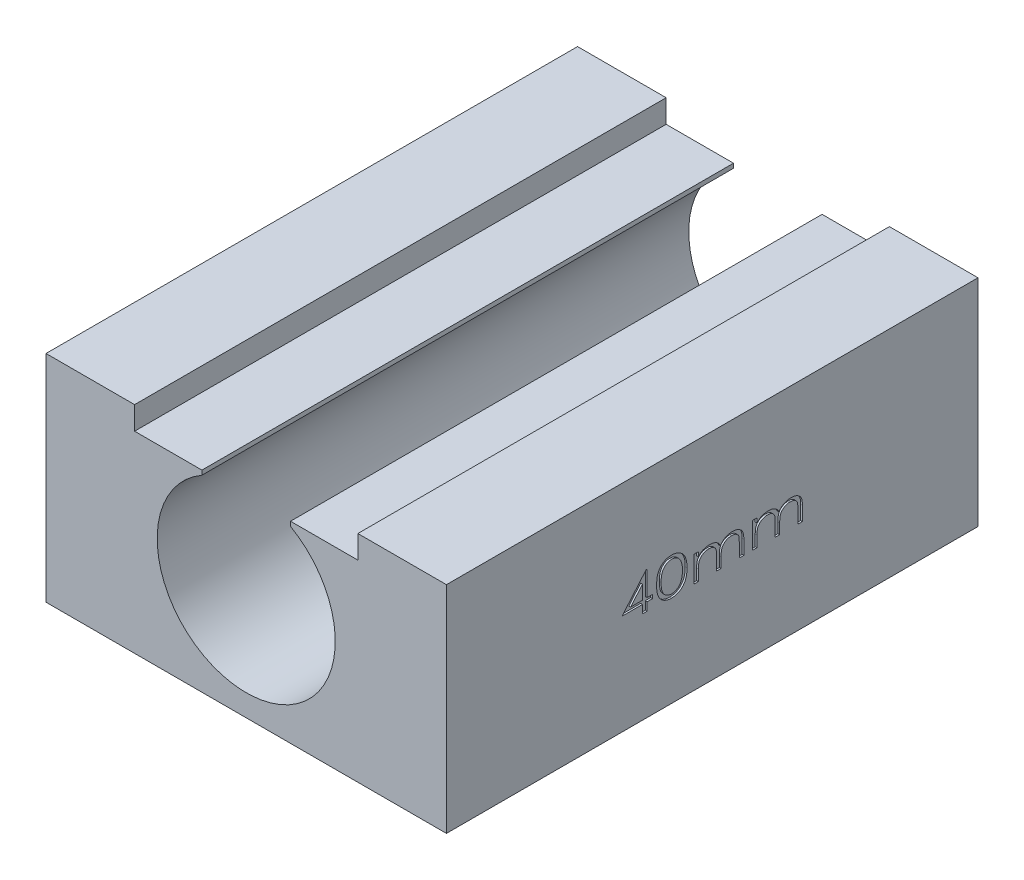
from build123d import *

# Parameters (mm, degrees)
BOSS_EXTRUDE1_DEPTH = 120
CUT_EXTRUDE1_DEPTH  = 0.4


with BuildPart() as part:
    # Sketch1 → Boss-Extrude1 (new body)
    with BuildSketch(Plane.XY):
        with BuildLine():
            Line((-25.2, 23.635882541), (-45.2, 23.635882541))
            Line((-45.2, 23.635882541), (-45.2, -25))
            Line((-45.2, -25), (45.2, -25))
            Line((45.2, -25), (45.2, 23.635882541))
            Line((45.2, 23.635882541), (25.2, 23.635882541))
            Line((25.2, 23.635882541), (25.2, 18.435882541))
            Line((25.2, 18.435882541), (10, 18.435882541))
            Line((10, 18.435882541), (10, 17.435882541))
            ThreePointArc((10, 17.435882541), (17.39267087, 10.074968983), (20.1, 0))
            ThreePointArc((20.1, 0), (-10.074968983, -17.39267087), (-10, 17.435882541))
            Line((-10, 17.435882541), (-10, 18.435882541))
            Line((-10, 18.435882541), (-25.2, 18.435882541))
            Line((-25.2, 18.435882541), (-25.2, 23.635882541))
        make_face()
    extrude(amount=BOSS_EXTRUDE1_DEPTH)

    # Sketch2 → Cut-Extrude1 (cut)
    # profile 1 of 4: a face of its own
    with BuildSketch(Plane(origin=(45.2, 0, 0), x_dir=(0, 0, -1), z_dir=(1, 0, 0))):
        Polygon((-74.924803049, 4.005721857), (-74.714867151, 4.005721857), (-74.714867151, -1.532739682), (-73.484097921, -1.532739682), (-73.484097921, -2.353252502), (-74.714867151, -2.353252502), (-74.714867151, -4.199406349), (-75.740508177, -4.199406349), (-75.740508177, -2.353252502), (-80.355892792, -2.353252502), align=None)
        Polygon((-75.740508177, -1.532739682), (-75.740508177, 1.606683395), (-78.421597921, -1.532739682), align=None, mode=Mode.SUBTRACT)
    # profile 2 of 4: a face of its own
    with BuildSketch(Plane(origin=(45.2, 0, 0), x_dir=(0, 0, -1), z_dir=(1, 0, 0))):
        with BuildLine():
            add(Edge.make_bspline(
                [(-72.561020998, -0.202611477), (-72.560026912, -0.074372807), (-72.558095312, 0.174806763), (-72.536395121, 0.53777982), (-72.503724806, 0.878469267), (-72.457297257, 1.196708698), (-72.399109436, 1.492473004), (-72.325084077, 1.765318934), (-72.239724216, 2.016757003), (-72.137309444, 2.245729747), (-72.024081299, 2.457321088), (-71.901208367, 2.654986597), (-71.76515028, 2.838404843), (-71.620265618, 3.010488209), (-71.461989685, 3.167198975), (-71.295461467, 3.313425394), (-71.114472531, 3.441898769), (-70.926158016, 3.561718227), (-70.727280656, 3.664316982), (-70.523882318, 3.756389772), (-70.314128593, 3.834134048), (-70.097899128, 3.895603635), (-69.876567228, 3.945991337), (-69.64953693, 3.980993014), (-69.416678653, 4.002496136), (-69.25925177, 4.004638202), (-69.179610741, 4.005721857)],
                knots=[0, 0, 0, 0, 1.503649737, 2.921730219, 4.262503284, 5.516075274, 6.69178641, 7.795021393, 8.829149449, 9.802301691, 10.73274031, 11.64178177, 12.528843777, 13.408754628, 14.276947477, 15.13851592, 16.004377863, 16.876899079, 17.753928666, 18.625955013, 19.494057458, 20.374325017, 21.26034682, 22.154305278, 23.06627747, 24, 24, 24, 24], degree=3))
            add(Edge.make_bspline(
                [(-69.179610741, 4.005721857), (-69.098901053, 4.00464507), (-68.939340692, 4.002516299), (-68.702771437, 3.980858252), (-68.471977342, 3.94612623), (-68.247365841, 3.895908458), (-68.028225564, 3.833530675), (-67.815017349, 3.756665929), (-67.607395616, 3.66478317), (-67.406292464, 3.559054828), (-67.211336658, 3.441527617), (-67.029057122, 3.306066042), (-66.856990896, 3.157868724), (-66.693744708, 2.997024802), (-66.542221441, 2.820754369), (-66.400615411, 2.630477857), (-66.268866316, 2.426812752), (-66.148716005, 2.207685193), (-66.03797916, 1.973326878), (-65.946406835, 1.71835279), (-65.865993941, 1.445610312), (-65.800194585, 1.153397717), (-65.751915486, 0.841097491), (-65.714441122, 0.510233498), (-65.694472798, 0.159812469), (-65.69100509, -0.079726142), (-65.689226126, -0.202611477)],
                knots=[0, 0, 0, 0, 0.937767327, 1.853934702, 2.758288811, 3.648489533, 4.526834912, 5.404653573, 6.280208139, 7.163258016, 8.043794659, 8.922907602, 9.798968251, 10.681341352, 11.583668834, 12.497519514, 13.43602634, 14.400218243, 15.40010499, 16.445002713, 17.545098876, 18.703307102, 19.92297783, 21.215983973, 22.571776222, 24, 24, 24, 24], degree=3))
            add(Edge.make_bspline(
                [(-65.689226126, -0.202611477), (-65.690067951, -0.324984732), (-65.691709025, -0.56354203), (-65.715724871, -0.912053268), (-65.749476082, -1.241673638), (-65.79922102, -1.55198649), (-65.862598025, -1.842820776), (-65.94200175, -2.114322349), (-66.031185637, -2.368495988), (-66.140743754, -2.601650864), (-66.259249543, -2.819190409), (-66.389753149, -3.021919862), (-66.53093541, -3.211633199), (-66.683121406, -3.387753934), (-66.845311282, -3.550793212), (-67.019542145, -3.698458732), (-67.203793208, -3.833746481), (-67.399063917, -3.953017929), (-67.601796543, -4.058699916), (-67.80978741, -4.152792406), (-68.025378695, -4.228564642), (-68.244983238, -4.293387459), (-68.470399772, -4.343349399), (-68.701780838, -4.377668852), (-68.938717282, -4.401802553), (-69.09888677, -4.403619054), (-69.179610741, -4.404534554)],
                knots=[0, 0, 0, 0, 1.42287291, 2.773781872, 4.060828387, 5.27520363, 6.426792035, 7.519939846, 8.563431598, 9.555755978, 10.512173935, 11.442739076, 12.357218209, 13.260166218, 14.147528077, 15.028911135, 15.913637702, 16.80332344, 17.686980587, 18.571336277, 19.455604679, 20.342248599, 21.23306151, 22.138037539, 23.061587774, 24, 24, 24, 24], degree=3))
            add(Edge.make_bspline(
                [(-69.179610741, -4.404534554), (-69.259250248, -4.40344324), (-69.416674121, -4.401286033), (-69.649554421, -4.379893706), (-69.875873315, -4.344580573), (-70.096248239, -4.296039144), (-70.311657786, -4.236261174), (-70.519894463, -4.158360741), (-70.722509128, -4.068067447), (-70.919636589, -3.966819674), (-71.10701233, -3.848968756), (-71.285854158, -3.719567227), (-71.453096858, -3.574217189), (-71.609440358, -3.415668617), (-71.756741902, -3.245136439), (-71.891275029, -3.059587568), (-72.016189851, -2.861062254), (-72.130895191, -2.647757735), (-72.234811884, -2.417193034), (-72.32237251, -2.164447606), (-72.395197832, -1.889928097), (-72.455671958, -1.594520166), (-72.50417061, -1.27742136), (-72.536267816, -0.938181633), (-72.558100708, -0.577363701), (-72.560030001, -0.329783169), (-72.561020998, -0.202611477)],
                knots=[0, 0, 0, 0, 0.934912173, 1.848046295, 2.743143733, 3.622812651, 4.496445533, 5.365654014, 6.230506444, 7.100190045, 7.965178933, 8.827069452, 9.689735607, 10.563481063, 11.439744394, 12.332993909, 13.25184041, 14.191956137, 15.174630498, 16.218062315, 17.328758704, 18.507220368, 19.757112638, 21.093352049, 22.506977365, 24, 24, 24, 24], degree=3))
        make_face()
        with BuildLine():
            add(Edge.make_bspline(
                [(-71.535379972, -0.199406349), (-71.534564195, -0.306264938), (-71.532980796, -0.513674324), (-71.517741073, -0.815060703), (-71.496549832, -1.096372406), (-71.46445813, -1.357336168), (-71.423389501, -1.598174072), (-71.372124487, -1.819042342), (-71.313888532, -2.020355297), (-71.244044335, -2.202316928), (-71.164624153, -2.368286309), (-71.077972831, -2.523428028), (-70.98184759, -2.667387449), (-70.87720065, -2.80166419), (-70.762920566, -2.92476742), (-70.641340286, -3.039647479), (-70.509012713, -3.1418699), (-70.324380814, -3.265003012), (-70.081655673, -3.392295059), (-69.777555073, -3.502065028), (-69.465264431, -3.570924676), (-69.253672719, -3.579647324), (-69.147559459, -3.584021733)],
                knots=[0, 0, 0, 0, 1.365459738, 2.650317286, 3.855581839, 4.969875765, 6.009123991, 6.976181044, 7.866094672, 8.685079231, 9.463722796, 10.215633472, 10.954035672, 11.673708734, 12.388704326, 13.098696342, 13.808786807, 14.5225756, 15.933291021, 17.298050938, 18.644972337, 20, 20, 20, 20], degree=3))
            add(Edge.make_bspline(
                [(-69.147559459, -3.584021733), (-69.040886464, -3.580391545), (-68.828673031, -3.573169711), (-68.517953712, -3.50354037), (-68.21703025, -3.397709348), (-67.97928308, -3.272420355), (-67.798904139, -3.151484135), (-67.669184097, -3.050369056), (-67.549763745, -2.935968246), (-67.437312032, -2.812722457), (-67.333241775, -2.678899576), (-67.241938389, -2.53187426), (-67.153525748, -2.377010766), (-67.104929544, -2.266661218), (-67.080251767, -2.210624297)],
                knots=[0, 0, 0, 0, 1.454656591, 2.893868968, 4.32661569, 5.801378547, 6.547894285, 7.290658755, 8.04398565, 8.803046969, 9.567556165, 10.354696976, 11.164493946, 12, 12, 12, 12], degree=3))
            add(Edge.make_bspline(
                [(-67.080251767, -2.210624297), (-67.051204958, -2.139326447), (-66.992390103, -1.994960408), (-66.916668484, -1.770044126), (-66.855006465, -1.534205295), (-66.803441885, -1.288198653), (-66.763778596, -1.031407107), (-66.734567166, -0.76355236), (-66.719321644, -0.484840004), (-66.71636798, -0.295575979), (-66.714867151, -0.199406349)],
                knots=[0, 0, 0, 0, 0.897532899, 1.817351705, 2.764618306, 3.738200912, 4.746854777, 5.793041112, 6.878590785, 8, 8, 8, 8], degree=3))
            add(Edge.make_bspline(
                [(-66.714867151, -0.199406349), (-66.715600009, -0.103226667), (-66.717034239, 0.085000459), (-66.73377358, 0.360295217), (-66.758959814, 0.622306988), (-66.794280583, 0.87093668), (-66.838067933, 1.106663425), (-66.894914159, 1.328416848), (-66.95967469, 1.537696174), (-67.037457306, 1.732922272), (-67.1213764, 1.916039729), (-67.215771344, 2.084716415), (-67.313997698, 2.243212914), (-67.423785169, 2.386728071), (-67.539019859, 2.520002974), (-67.664551148, 2.637868428), (-67.796243336, 2.744937605), (-67.981219436, 2.866872402), (-68.222476709, 2.993093419), (-68.522894597, 3.105559637), (-68.833279946, 3.171511091), (-69.042558122, 3.180632528), (-69.147559459, 3.185209036)],
                knots=[0, 0, 0, 0, 1.229525781, 2.406226545, 3.524826222, 4.594047567, 5.616071261, 6.588417605, 7.519395492, 8.41479633, 9.273418453, 10.092675396, 10.884690884, 11.655091559, 12.400379745, 13.134697013, 13.85360731, 14.56773274, 15.963844624, 17.325176792, 18.657958416, 20, 20, 20, 20], degree=3))
            add(Edge.make_bspline(
                [(-69.147559459, 3.185209036), (-69.25469801, 3.180686674), (-69.467164667, 3.17171837), (-69.781309581, 3.105786675), (-70.08347431, 2.993474896), (-70.324438884, 2.867144069), (-70.507987279, 2.746473427), (-70.638081783, 2.643339341), (-70.759972284, 2.529885206), (-70.872006915, 2.404842862), (-70.979258224, 2.272995738), (-71.072448697, 2.12670705), (-71.162035625, 1.973328761), (-71.240258336, 1.806241301), (-71.312874843, 1.625187799), (-71.370040308, 1.42382887), (-71.422391944, 1.203228466), (-71.462248601, 0.961566171), (-71.496989962, 0.700362325), (-71.517708378, 0.418370888), (-71.533002531, 0.116467925), (-71.534571665, -0.092012115), (-71.535379972, -0.199406349)],
                knots=[0, 0, 0, 0, 1.368599115, 2.714071407, 4.081120454, 5.476525329, 6.180825298, 6.88552213, 7.595489274, 8.305850116, 9.029726763, 9.764338507, 10.519592943, 11.298209231, 12.119636502, 13.009518955, 13.969893518, 15.015831986, 16.137713852, 17.336131509, 18.62776257, 20, 20, 20, 20], degree=3))
        make_face(mode=Mode.SUBTRACT)
    # profile 3 of 4: a face of its own
    with BuildSketch(Plane(origin=(45.2, 0, 0), x_dir=(0, 0, -1), z_dir=(1, 0, 0))):
        with BuildLine():
            Line((-64.150764587, 1.646747498), (-63.125123562, 1.646747498))
            Line((-63.125123562, 1.646747498), (-63.125123562, 0.630721857))
            add(Edge.make_bspline(
                [(-63.125123562, 0.630721857), (-63.041653547, 0.719816459), (-62.880494422, 0.891835216), (-62.622398736, 1.117701161), (-62.361455922, 1.306361662), (-62.178588335, 1.404987374), (-62.089867151, 1.452837241)],
                knots=[0, 0, 0, 0, 1.101334499, 2.126393606, 3.090989394, 4, 4, 4, 4], degree=3))
            add(Edge.make_bspline(
                [(-62.089867151, 1.452837241), (-61.967290948, 1.498695485), (-61.722050612, 1.59044487), (-61.339142314, 1.681493905), (-60.94732113, 1.737742561), (-60.683007619, 1.745434924), (-60.549803049, 1.7493116)],
                knots=[0, 0, 0, 0, 0.994664579, 1.990042673, 2.987053289, 4, 4, 4, 4], degree=3))
            add(Edge.make_bspline(
                [(-60.549803049, 1.7493116), (-60.459986164, 1.746891226), (-60.281980961, 1.742094364), (-60.018518742, 1.711844978), (-59.762446701, 1.658277104), (-59.515878041, 1.585302655), (-59.283974938, 1.494744327), (-59.070779994, 1.391102783), (-58.880247119, 1.272258875), (-58.709854845, 1.136733615), (-58.555221307, 0.979432279), (-58.416897689, 0.792607256), (-58.285078187, 0.578415679), (-58.212616914, 0.420079993), (-58.174803049, 0.337452626)],
                knots=[0, 0, 0, 0, 1.097936986, 2.175966114, 3.236309504, 4.292038786, 5.315449249, 6.276199239, 7.185677523, 8.054516777, 8.931828901, 9.873415976, 10.89024361, 12, 12, 12, 12], degree=3))
            add(Edge.make_bspline(
                [(-58.174803049, 0.337452626), (-58.133812949, 0.394062026), (-58.052779246, 0.505973669), (-57.920248597, 0.66360952), (-57.781276862, 0.810936566), (-57.634529132, 0.947842964), (-57.48091772, 1.074903454), (-57.318120294, 1.190251135), (-57.148746328, 1.296199766), (-56.971594989, 1.390427932), (-56.790195145, 1.475688066), (-56.603231876, 1.547123531), (-56.414202776, 1.610089958), (-56.221262333, 1.662273926), (-56.024361241, 1.699147012), (-55.82464073, 1.72958217), (-55.621082929, 1.744724744), (-55.484116527, 1.747776029), (-55.415187664, 1.7493116)],
                knots=[0, 0, 0, 0, 1.039411854, 2.054822818, 3.061019193, 4.05054071, 5.038497512, 6.024150636, 7.01641242, 8.008324128, 9.007340492, 9.996063995, 10.983637224, 11.970538841, 12.966389747, 13.962082115, 14.974410077, 16, 16, 16, 16], degree=3))
            add(Edge.make_bspline(
                [(-55.415187664, 1.7493116), (-55.289466152, 1.745567949), (-55.043667416, 1.73824872), (-54.686381563, 1.682675614), (-54.352769104, 1.584866242), (-54.092500211, 1.474467321), (-53.899771386, 1.36690833), (-53.764263109, 1.280515494), (-53.638801566, 1.185735011), (-53.523557383, 1.082892174), (-53.41687132, 0.973634803), (-53.320445707, 0.856173022), (-53.233718943, 0.730704703), (-53.155816117, 0.596542834), (-53.087605674, 0.449664024), (-53.028586086, 0.28780019), (-52.979506154, 0.108592248), (-52.937889328, -0.086644976), (-52.906195417, -0.299127426), (-52.884116175, -0.528599788), (-52.871717004, -0.775123514), (-52.869734925, -0.945119107), (-52.868713305, -1.032739682)],
                knots=[0, 0, 0, 0, 1.740464184, 3.402789947, 4.989803156, 6.543756859, 7.305282768, 8.043905867, 8.76729876, 9.479833, 10.180755368, 10.879684531, 11.581387001, 12.290573372, 13.025185819, 13.820792516, 14.673231865, 15.595880932, 16.58337464, 17.646144414, 18.78675573, 20, 20, 20, 20], degree=3))
            Line((-52.868713305, -1.032739682), (-52.868713305, -4.199406349))
            Line((-52.868713305, -4.199406349), (-53.894354331, -4.199406349))
            Line((-53.894354331, -4.199406349), (-53.894354331, -1.029534554))
            add(Edge.make_bspline(
                [(-53.894354331, -1.029534554), (-53.89504573, -0.954740906), (-53.896374618, -0.810985543), (-53.904281105, -0.604701029), (-53.916977496, -0.416565818), (-53.933803667, -0.246945277), (-53.957177858, -0.095313389), (-53.988466188, 0.037468709), (-54.02002692, 0.153733054), (-54.074385461, 0.28249911), (-54.159861613, 0.42592123), (-54.292781737, 0.577347893), (-54.456712878, 0.709907312), (-54.646878229, 0.824514671), (-54.862426388, 0.917384594), (-55.099401939, 0.984219641), (-55.356617785, 1.025046038), (-55.53468866, 1.029210463), (-55.626726126, 1.031362882)],
                knots=[0, 0, 0, 0, 1.143235671, 2.197329106, 3.154880607, 4.025032827, 4.80226628, 5.497502554, 6.10988775, 6.640621586, 7.629243892, 8.647760737, 9.703686775, 10.839345356, 12.03156705, 13.279871875, 14.594078343, 16, 16, 16, 16], degree=3))
            add(Edge.make_bspline(
                [(-55.626726126, 1.031362882), (-55.739745514, 1.028101675), (-55.962683799, 1.021668727), (-56.288724179, 0.957474204), (-56.60125091, 0.858864871), (-56.846429118, 0.74108689), (-57.030324595, 0.629201775), (-57.160971439, 0.540800889), (-57.278777614, 0.441265847), (-57.391105345, 0.34001017), (-57.489778169, 0.227695788), (-57.58212065, 0.111758766), (-57.661691934, -0.013264077), (-57.736232245, -0.144643321), (-57.799978277, -0.292035349), (-57.851172588, -0.460195254), (-57.89834413, -0.649285916), (-57.933881403, -0.861576276), (-57.962419341, -1.095788142), (-57.983329665, -1.352386791), (-57.993484666, -1.631482506), (-57.995744962, -1.824934174), (-57.996918433, -1.925367887)],
                knots=[0, 0, 0, 0, 1.556903216, 3.071095483, 4.564446392, 6.066981442, 6.807334089, 7.532765981, 8.239247881, 8.932547991, 9.615914017, 10.298207098, 10.974548501, 11.657159667, 12.37974319, 13.183533278, 14.078680921, 15.065747533, 16.149441298, 17.332010949, 18.614868254, 20, 20, 20, 20], degree=3))
            Line((-57.996918433, -1.925367887), (-57.996918433, -4.199406349))
            Line((-57.996918433, -4.199406349), (-59.022559459, -4.199406349))
            Line((-59.022559459, -4.199406349), (-59.022559459, -1.226649938))
            add(Edge.make_bspline(
                [(-59.022559459, -1.226649938), (-59.0235274, -1.142787342), (-59.025389565, -0.981448849), (-59.029661175, -0.749898127), (-59.045887735, -0.539551398), (-59.06146252, -0.350000843), (-59.086594901, -0.182424669), (-59.111810369, -0.034493752), (-59.147374684, 0.091014565), (-59.197755418, 0.231675513), (-59.284201697, 0.384240916), (-59.415714512, 0.547467097), (-59.580524026, 0.689037937), (-59.773554718, 0.810351456), (-59.990820493, 0.908766559), (-60.229557993, 0.982308043), (-60.488577721, 1.022990742), (-60.667722514, 1.028521862), (-60.759738946, 1.031362882)],
                knots=[0, 0, 0, 0, 1.211839033, 2.33138837, 3.344841969, 4.259525628, 5.078153091, 5.792650174, 6.42558092, 6.960361837, 7.948398424, 8.941636425, 9.97554415, 11.071839529, 12.22542993, 13.411959769, 14.670671777, 16, 16, 16, 16], degree=3))
            add(Edge.make_bspline(
                [(-60.759738946, 1.031362882), (-60.868460347, 1.027873461), (-61.084347418, 1.020944551), (-61.401952371, 0.958966902), (-61.70879632, 0.860977592), (-62.000150434, 0.725434177), (-62.268291654, 0.558174404), (-62.50173878, 0.358978893), (-62.698825725, 0.133474497), (-62.832207328, -0.078296011), (-62.917149199, -0.266341458), (-62.973361356, -0.424981374), (-63.021217307, -0.601176421), (-63.058481614, -0.795257142), (-63.089600462, -1.00638085), (-63.109093834, -1.234904077), (-63.122348427, -1.48130193), (-63.124175895, -1.651309764), (-63.125123562, -1.739470451)],
                knots=[0, 0, 0, 0, 1.253911763, 2.489880891, 3.720346689, 4.964532809, 6.189408473, 7.357155804, 8.493500514, 9.634703169, 10.23074931, 10.872413263, 11.57546153, 12.336099474, 13.15231585, 14.037710173, 14.982418548, 16, 16, 16, 16], degree=3))
            Line((-63.125123562, -1.739470451), (-63.125123562, -4.199406349))
            Line((-63.125123562, -4.199406349), (-64.150764587, -4.199406349))
            Line((-64.150764587, -4.199406349), (-64.150764587, 1.646747498))
        make_face()
    # profile 4 of 4: a face of its own
    with BuildSketch(Plane(origin=(45.2, 0, 0), x_dir=(0, 0, -1), z_dir=(1, 0, 0))):
        with BuildLine():
            Line((-50.919995357, 1.646747498), (-49.894354331, 1.646747498))
            Line((-49.894354331, 1.646747498), (-49.894354331, 0.630721857))
            add(Edge.make_bspline(
                [(-49.894354331, 0.630721857), (-49.810884316, 0.719816459), (-49.649725191, 0.891835216), (-49.391629505, 1.117701161), (-49.130686691, 1.306361662), (-48.947819104, 1.404987374), (-48.859097921, 1.452837241)],
                knots=[0, 0, 0, 0, 1.101334499, 2.126393606, 3.090989394, 4, 4, 4, 4], degree=3))
            add(Edge.make_bspline(
                [(-48.859097921, 1.452837241), (-48.736521717, 1.498695485), (-48.491281381, 1.59044487), (-48.108373083, 1.681493905), (-47.716551899, 1.737742561), (-47.452238388, 1.745434924), (-47.319033818, 1.7493116)],
                knots=[0, 0, 0, 0, 0.994664579, 1.990042673, 2.987053289, 4, 4, 4, 4], degree=3))
            add(Edge.make_bspline(
                [(-47.319033818, 1.7493116), (-47.229216934, 1.746891226), (-47.05121173, 1.742094364), (-46.787749511, 1.711844978), (-46.53167747, 1.658277104), (-46.28510881, 1.585302655), (-46.053205707, 1.494744327), (-45.840010763, 1.391102783), (-45.649477888, 1.272258875), (-45.479085614, 1.136733615), (-45.324452077, 0.979432279), (-45.186128458, 0.792607256), (-45.054308956, 0.578415679), (-44.981847683, 0.420079993), (-44.944033818, 0.337452626)],
                knots=[0, 0, 0, 0, 1.097936986, 2.175966114, 3.236309504, 4.292038786, 5.315449249, 6.276199239, 7.185677523, 8.054516777, 8.931828901, 9.873415976, 10.89024361, 12, 12, 12, 12], degree=3))
            add(Edge.make_bspline(
                [(-44.944033818, 0.337452626), (-44.903043718, 0.394062026), (-44.822010015, 0.505973669), (-44.689479366, 0.66360952), (-44.550507631, 0.810936566), (-44.403759902, 0.947842964), (-44.25014849, 1.074903454), (-44.087351063, 1.190251135), (-43.917977097, 1.296199766), (-43.740825758, 1.390427932), (-43.559425914, 1.475688066), (-43.372462645, 1.547123531), (-43.183433545, 1.610089958), (-42.990493102, 1.662273926), (-42.79359201, 1.699147012), (-42.593871499, 1.72958217), (-42.390313698, 1.744724744), (-42.253347296, 1.747776029), (-42.184418433, 1.7493116)],
                knots=[0, 0, 0, 0, 1.039411854, 2.054822818, 3.061019193, 4.05054071, 5.038497512, 6.024150636, 7.01641242, 8.008324128, 9.007340492, 9.996063995, 10.983637224, 11.970538841, 12.966389747, 13.962082115, 14.974410077, 16, 16, 16, 16], degree=3))
            add(Edge.make_bspline(
                [(-42.184418433, 1.7493116), (-42.058696921, 1.745567949), (-41.812898185, 1.73824872), (-41.455612332, 1.682675614), (-41.121999873, 1.584866242), (-40.86173098, 1.474467321), (-40.669002155, 1.36690833), (-40.533493879, 1.280515494), (-40.408032335, 1.185735011), (-40.292788152, 1.082892174), (-40.186102089, 0.973634803), (-40.089676476, 0.856173022), (-40.002949712, 0.730704703), (-39.925046886, 0.596542834), (-39.856836443, 0.449664024), (-39.797816855, 0.28780019), (-39.748736924, 0.108592248), (-39.707120098, -0.086644976), (-39.675426186, -0.299127426), (-39.653346944, -0.528599788), (-39.640947773, -0.775123514), (-39.638965694, -0.945119107), (-39.637944074, -1.032739682)],
                knots=[0, 0, 0, 0, 1.740464184, 3.402789947, 4.989803156, 6.543756859, 7.305282768, 8.043905867, 8.76729876, 9.479833, 10.180755368, 10.879684531, 11.581387001, 12.290573372, 13.025185819, 13.820792516, 14.673231865, 15.595880932, 16.58337464, 17.646144414, 18.78675573, 20, 20, 20, 20], degree=3))
            Line((-39.637944074, -1.032739682), (-39.637944074, -4.199406349))
            Line((-39.637944074, -4.199406349), (-40.6635851, -4.199406349))
            Line((-40.6635851, -4.199406349), (-40.6635851, -1.029534554))
            add(Edge.make_bspline(
                [(-40.6635851, -1.029534554), (-40.664276499, -0.954740906), (-40.665605387, -0.810985543), (-40.673511874, -0.604701029), (-40.686208265, -0.416565818), (-40.703034436, -0.246945277), (-40.726408627, -0.095313389), (-40.757696957, 0.037468709), (-40.789257689, 0.153733054), (-40.843616231, 0.28249911), (-40.929092382, 0.42592123), (-41.062012507, 0.577347893), (-41.225943647, 0.709907312), (-41.416108998, 0.824514671), (-41.631657158, 0.917384594), (-41.868632709, 0.984219641), (-42.125848555, 1.025046038), (-42.303919429, 1.029210463), (-42.395956895, 1.031362882)],
                knots=[0, 0, 0, 0, 1.143235671, 2.197329106, 3.154880607, 4.025032827, 4.80226628, 5.497502554, 6.10988775, 6.640621586, 7.629243892, 8.647760737, 9.703686775, 10.839345356, 12.03156705, 13.279871875, 14.594078343, 16, 16, 16, 16], degree=3))
            add(Edge.make_bspline(
                [(-42.395956895, 1.031362882), (-42.508976283, 1.028101675), (-42.731914568, 1.021668727), (-43.057954948, 0.957474204), (-43.370481679, 0.858864871), (-43.615659887, 0.74108689), (-43.799555364, 0.629201775), (-43.930202208, 0.540800889), (-44.048008384, 0.441265847), (-44.160336114, 0.34001017), (-44.259008938, 0.227695788), (-44.351351419, 0.111758766), (-44.430922703, -0.013264077), (-44.505463014, -0.144643321), (-44.569209046, -0.292035349), (-44.620403358, -0.460195254), (-44.667574899, -0.649285916), (-44.703112172, -0.861576276), (-44.73165011, -1.095788142), (-44.752560435, -1.352386791), (-44.762715436, -1.631482506), (-44.764975732, -1.824934174), (-44.766149203, -1.925367887)],
                knots=[0, 0, 0, 0, 1.556903216, 3.071095483, 4.564446392, 6.066981442, 6.807334089, 7.532765981, 8.239247881, 8.932547991, 9.615914017, 10.298207098, 10.974548501, 11.657159667, 12.37974319, 13.183533278, 14.078680921, 15.065747533, 16.149441298, 17.332010949, 18.614868254, 20, 20, 20, 20], degree=3))
            Line((-44.766149203, -1.925367887), (-44.766149203, -4.199406349))
            Line((-44.766149203, -4.199406349), (-45.791790228, -4.199406349))
            Line((-45.791790228, -4.199406349), (-45.791790228, -1.226649938))
            add(Edge.make_bspline(
                [(-45.791790228, -1.226649938), (-45.792758169, -1.142787342), (-45.794620334, -0.981448849), (-45.798891944, -0.749898127), (-45.815118504, -0.539551398), (-45.83069329, -0.350000843), (-45.85582567, -0.182424669), (-45.881041138, -0.034493752), (-45.916605453, 0.091014565), (-45.966986188, 0.231675513), (-46.053432466, 0.384240916), (-46.184945281, 0.547467097), (-46.349754795, 0.689037937), (-46.542785487, 0.810351456), (-46.760051263, 0.908766559), (-46.998788762, 0.982308043), (-47.25780849, 1.022990742), (-47.436953283, 1.028521862), (-47.528969716, 1.031362882)],
                knots=[0, 0, 0, 0, 1.211839033, 2.33138837, 3.344841969, 4.259525628, 5.078153091, 5.792650174, 6.42558092, 6.960361837, 7.948398424, 8.941636425, 9.97554415, 11.071839529, 12.22542993, 13.411959769, 14.670671777, 16, 16, 16, 16], degree=3))
            add(Edge.make_bspline(
                [(-47.528969716, 1.031362882), (-47.637691116, 1.027873461), (-47.853578187, 1.020944551), (-48.17118314, 0.958966902), (-48.478027089, 0.860977592), (-48.769381203, 0.725434177), (-49.037522423, 0.558174404), (-49.270969549, 0.358978893), (-49.468056495, 0.133474497), (-49.601438097, -0.078296011), (-49.686379969, -0.266341458), (-49.742592125, -0.424981374), (-49.790448076, -0.601176421), (-49.827712383, -0.795257142), (-49.858831231, -1.00638085), (-49.878324603, -1.234904077), (-49.891579196, -1.48130193), (-49.893406664, -1.651309764), (-49.894354331, -1.739470451)],
                knots=[0, 0, 0, 0, 1.253911763, 2.489880891, 3.720346689, 4.964532809, 6.189408473, 7.357155804, 8.493500514, 9.634703169, 10.23074931, 10.872413263, 11.57546153, 12.336099474, 13.15231585, 14.037710173, 14.982418548, 16, 16, 16, 16], degree=3))
            Line((-49.894354331, -1.739470451), (-49.894354331, -4.199406349))
            Line((-49.894354331, -4.199406349), (-50.919995357, -4.199406349))
            Line((-50.919995357, -4.199406349), (-50.919995357, 1.646747498))
        make_face()
    extrude(amount=-CUT_EXTRUDE1_DEPTH, mode=Mode.SUBTRACT)


solid = part.part
